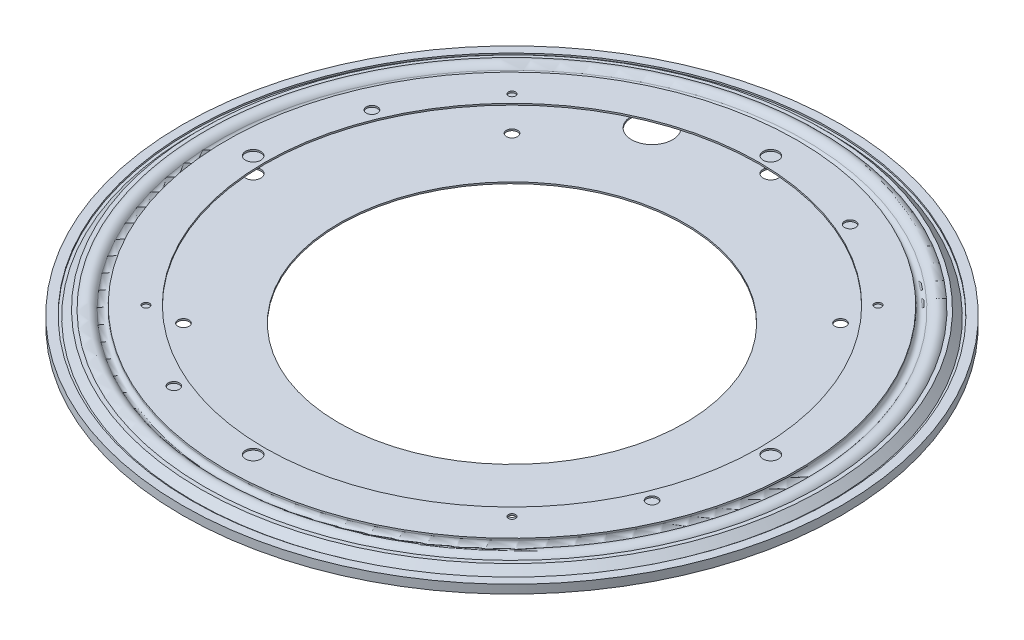
from build123d import *

# Parameters (mm, degrees)
CIRPATTERN1_COUNT  = 12
SKETCH3_R          = 9.525
CUT_EXTRUDE1_DEPTH = 217.777714045
SKETCH4_W          = 3.571875
SKETCH4_H          = 0.7366
CIRPATTERN2_COUNT  = 4
CIRPATTERN3_COUNT  = 4
SKETCH8_W          = 2.579751
SKETCH8_H          = 0.7366
CIRPATTERN4_COUNT  = 4
SKETCH10_W         = 1.651
SKETCH10_H         = 0.7366
CIRPATTERN5_COUNT  = 4
SKETCH12_W         = 2.579751
SKETCH12_H         = 0.7366
CIRPATTERN6_COUNT  = 4


with BuildPart() as part:
    # Sketch1 → Revolve-Thin1 (revolve)
    with BuildSketch(Plane.XY, mode=Mode.PRIVATE) as revolve_thin1_sk:
        with BuildLine():
            Line((149.1361, 0), (153.2001, 0))
            Line((153.2001, 0), (153.2001, -3.9751))
            Line((153.2001, -3.9751), (146.734585766, -3.9751))
            Line((146.734585766, -3.9751), (146.734585766, -3.175))
            ThreePointArc((146.734585766, -3.175), (145.297766957, -1.265274848), (143.064690511, -2.116666667))
            ThreePointArc((143.064690511, -2.116666667), (139.7, -3.9751), (136.335309489, -2.116666667))
            ThreePointArc((136.335309489, -2.116666667), (134.102233043, -1.265274848), (132.665414234, -3.175))
            Line((132.665414234, -3.175), (132.665414234, -3.9751))
            Line((132.665414234, -3.9751), (80.391, -3.9751))
            Line((80.391, -3.9751), (80.391, -3.2385))
            Line((80.391, -3.2385), (131.928814234, -3.2385))
            Line((131.928814234, -3.2385), (131.928814234, -3.175))
            ThreePointArc((131.928814234, -3.175), (133.898128192, -0.557517283), (136.958798466, -1.724440895))
            ThreePointArc((136.958798466, -1.724440895), (139.7, -3.2385), (142.441201534, -1.724440895))
            ThreePointArc((142.441201534, -1.724440895), (145.501871808, -0.557517283), (147.471185766, -3.175))
            Line((147.471185766, -3.175), (147.471185766, -3.2385))
            Line((147.471185766, -3.2385), (152.4635, -3.2385))
            Line((152.4635, -3.2385), (152.4635, -0.7366))
            Line((152.4635, -0.7366), (149.1361, -0.7366))
            Line((149.1361, -0.7366), (149.1361, 0))
        make_face()
    revolve(revolve_thin1_sk.sketch.rotate(Axis((0, 21.71272626, 0), (0, -1, 0)), 90), axis=Axis((0, 21.71272626, 0), (0, -1, 0)))

    # Sketch3 → Cut-Extrude1 (cut, through all)
    with BuildSketch(Plane(origin=(0, -3.2385, 0), x_dir=(-1, 0, 0), z_dir=(0, 1, 0))):
        with Locations(Location((-46.020093648, 111.102334226, 0), (0, 0, 90))):
            Circle(SKETCH3_R)
        with Locations(Location((46.020093648, -111.102334226, 0), (0, 0, 270))):
            Circle(SKETCH3_R)
    extrude(amount=-CUT_EXTRUDE1_DEPTH, mode=Mode.SUBTRACT)

    # Sketch6 → 9/32 (0.281250) Diameter Hole2 (revolve, cut)
    with BuildSketch(Plane(origin=(0, -3.2385, -120.2563), x_dir=(0, 0, 1), z_dir=(1, 0, 0))):
        Polygon((0, 0), (0, 10.274199024), (3.571875, 8.128), (3.571875, 0), align=None)
    f_9_32_0_281250_diameter_hole2 = revolve(axis=Axis((0, 3.1115, -120.2563), (0, -1, 0)), mode=Mode.SUBTRACT)

    # CirPattern3: 9/32 (0.281250) Diameter Hole2 ×4 about axis
    cirpattern3_axis = Axis((0, 0, 0), (0, 1, 0))
    for i in range(1, CIRPATTERN3_COUNT):
        add(f_9_32_0_281250_diameter_hole2.rotate(cirpattern3_axis, i * 360 / CIRPATTERN3_COUNT), mode=Mode.SUBTRACT)

    # Sketch12 → 13/64 (0.203130) Diameter Hole2 (revolve, cut)
    with BuildSketch(Plane(origin=(76.332177029, -3.2385, -76.332177029), x_dir=(0, 0, 1), z_dir=(1, 0, 0))):
        with Locations((1.2898755, 0.3683)):
            Rectangle(SKETCH12_W, SKETCH12_H)
    f_13_64_0_203130_diameter_hole2 = revolve(axis=Axis((76.332177029, 3.1115, -76.332177029), (0, -1, 0)), mode=Mode.SUBTRACT)

    # CirPattern6: 13/64 (0.203130) Diameter Hole2 ×4 about axis
    cirpattern6_axis = Axis((0, 0, 0), (0, 1, 0))
    for i in range(1, CIRPATTERN6_COUNT):
        add(f_13_64_0_203130_diameter_hole2.rotate(cirpattern6_axis, i * 360 / CIRPATTERN6_COUNT), mode=Mode.SUBTRACT)


with BuildPart() as body_2:
    # Sketch1<7> → Revolve-Thin2 (revolve)
    with BuildSketch(Plane.XY, mode=Mode.PRIVATE) as revolve_thin2_sk:
        with BuildLine():
            Line((151.1681, -0.889), (147.965932768, -0.889))
            Line((147.965932768, -0.889), (144.747035766, 2.329897002))
            Line((144.747035766, 2.329897002), (142.920714202, 2.329897002))
            ThreePointArc((142.920714202, 2.329897002), (139.57135674, 3.973017861), (136.335309489, 2.116666667))
            ThreePointArc((136.335309489, 2.116666667), (134.102233043, 1.265274848), (132.665414234, 3.175))
            Line((132.665414234, 3.175), (132.665414234, 3.9751))
            Line((132.665414234, 3.9751), (114.8969, 3.9751))
            Line((114.8969, 3.9751), (114.8969, 3.2385))
            Line((114.8969, 3.2385), (131.928814234, 3.2385))
            Line((131.928814234, 3.2385), (131.928814234, 3.175))
            ThreePointArc((131.928814234, 3.175), (133.898128192, 0.557517283), (136.958798466, 1.724440895))
            ThreePointArc((136.958798466, 1.724440895), (139.776356445, 3.237599719), (142.51944798, 1.593297002))
            Line((142.51944798, 1.593297002), (144.441926056, 1.593297002))
            Line((144.441926056, 1.593297002), (147.660823058, -1.6256))
            Line((147.660823058, -1.6256), (151.1681, -1.6256))
            Line((151.1681, -1.6256), (151.1681, -0.889))
        make_face()
    revolve(revolve_thin2_sk.sketch.rotate(Axis((0, 21.71272626, 0), (0, -1, 0)), 90), axis=Axis((0, 21.71272626, 0), (0, -1, 0)))

    # Sketch4 → 9/32 (0.281250) Diameter Hole1 (revolve, cut)
    with BuildSketch(Plane(origin=(0, 3.9751, -120.2563), x_dir=(0, 0, 1), z_dir=(1, 0, 0))):
        with Locations((1.7859375, 0.3683)):
            Rectangle(SKETCH4_W, SKETCH4_H)
    f_9_32_0_281250_diameter_hole1 = revolve(axis=Axis((0, 10.3251, -120.2563), (0, -1, 0)), mode=Mode.SUBTRACT)

    # CirPattern2: 9/32 (0.281250) Diameter Hole1 ×4 about axis
    cirpattern2_axis = Axis((0, 0, 0), (0, 1, 0))
    for i in range(1, CIRPATTERN2_COUNT):
        add(f_9_32_0_281250_diameter_hole1.rotate(cirpattern2_axis, i * 360 / CIRPATTERN2_COUNT), mode=Mode.SUBTRACT)

    # Sketch8 → 13/64 (0.203130) Diameter Hole1 (revolve, cut)
    with BuildSketch(Plane(origin=(46.020093648, 3.9751, -111.102334226), x_dir=(0, 0, 1), z_dir=(1, 0, 0))):
        with Locations((1.2898755, 0.3683)):
            Rectangle(SKETCH8_W, SKETCH8_H)
    f_13_64_0_203130_diameter_hole1 = revolve(axis=Axis((46.020093648, 10.3251, -111.102334226), (0, -1, 0)), mode=Mode.SUBTRACT)

    # CirPattern4: 13/64 (0.203130) Diameter Hole1 ×4 about axis
    cirpattern4_axis = Axis((0, 0, 0), (0, 1, 0))
    for i in range(1, CIRPATTERN4_COUNT):
        add(f_13_64_0_203130_diameter_hole1.rotate(cirpattern4_axis, i * 360 / CIRPATTERN4_COUNT), mode=Mode.SUBTRACT)

    # Sketch10 → 1/8 (0.125000) Diameter Hole1 (revolve, cut)
    with BuildSketch(Plane(origin=(85.03404521, 3.9751, -85.03404521), x_dir=(0, 0, 1), z_dir=(1, 0, 0))):
        with Locations((0.8255, 0.3683)):
            Rectangle(SKETCH10_W, SKETCH10_H)
    f_1_8_0_125000_diameter_hole1 = revolve(axis=Axis((85.03404521, 10.3251, -85.03404521), (0, -1, 0)), mode=Mode.SUBTRACT)

    # CirPattern5: 1/8 (0.125000) Diameter Hole1 ×4 about axis
    cirpattern5_axis = Axis((0, 0, 0), (0, 1, 0))
    for i in range(1, CIRPATTERN5_COUNT):
        add(f_1_8_0_125000_diameter_hole1.rotate(cirpattern5_axis, i * 360 / CIRPATTERN5_COUNT), mode=Mode.SUBTRACT)


with BuildPart() as body_3:
    # Sketch2 → Revolve1 (revolve)
    with BuildSketch(Plane.XY):
        with BuildLine():
            Line((139.7, 3.1877), (139.7, -3.1877))
            ThreePointArc((139.7, -3.1877), (142.8877, 0), (139.7, 3.1877))
        make_face()
    revolve(axis=Axis((139.7, 5.355428419, 0), (0, -1, 0)))


with BuildPart() as cirpattern1_1:
    # CirPattern1: pattern copy
    add(body_3.part.rotate(Axis((0, 0, 0), (0, 1, 0)), 1 * 360 / CIRPATTERN1_COUNT))


with BuildPart() as cirpattern1_2:
    # CirPattern1: pattern copy
    add(body_3.part.rotate(Axis((0, 0, 0), (0, 1, 0)), 2 * 360 / CIRPATTERN1_COUNT))


with BuildPart() as cirpattern1_3:
    # CirPattern1: pattern copy
    add(body_3.part.rotate(Axis((0, 0, 0), (0, 1, 0)), 3 * 360 / CIRPATTERN1_COUNT))


with BuildPart() as cirpattern1_4:
    # CirPattern1: pattern copy
    add(body_3.part.rotate(Axis((0, 0, 0), (0, 1, 0)), 4 * 360 / CIRPATTERN1_COUNT))


with BuildPart() as cirpattern1_5:
    # CirPattern1: pattern copy
    add(body_3.part.rotate(Axis((0, 0, 0), (0, 1, 0)), 5 * 360 / CIRPATTERN1_COUNT))


with BuildPart() as cirpattern1_6:
    # CirPattern1: pattern copy
    add(body_3.part.rotate(Axis((0, 0, 0), (0, 1, 0)), 6 * 360 / CIRPATTERN1_COUNT))


with BuildPart() as cirpattern1_7:
    # CirPattern1: pattern copy
    add(body_3.part.rotate(Axis((0, 0, 0), (0, 1, 0)), 7 * 360 / CIRPATTERN1_COUNT))


with BuildPart() as cirpattern1_8:
    # CirPattern1: pattern copy
    add(body_3.part.rotate(Axis((0, 0, 0), (0, 1, 0)), 8 * 360 / CIRPATTERN1_COUNT))


with BuildPart() as cirpattern1_9:
    # CirPattern1: pattern copy
    add(body_3.part.rotate(Axis((0, 0, 0), (0, 1, 0)), 9 * 360 / CIRPATTERN1_COUNT))


with BuildPart() as cirpattern1_10:
    # CirPattern1: pattern copy
    add(body_3.part.rotate(Axis((0, 0, 0), (0, 1, 0)), 10 * 360 / CIRPATTERN1_COUNT))


with BuildPart() as cirpattern1_11:
    # CirPattern1: pattern copy
    add(body_3.part.rotate(Axis((0, 0, 0), (0, 1, 0)), 11 * 360 / CIRPATTERN1_COUNT))


solid = Compound([part.part, body_2.part, body_3.part, cirpattern1_1.part, cirpattern1_2.part, cirpattern1_3.part, cirpattern1_4.part, cirpattern1_5.part, cirpattern1_6.part, cirpattern1_7.part, cirpattern1_8.part, cirpattern1_9.part, cirpattern1_10.part, cirpattern1_11.part])
